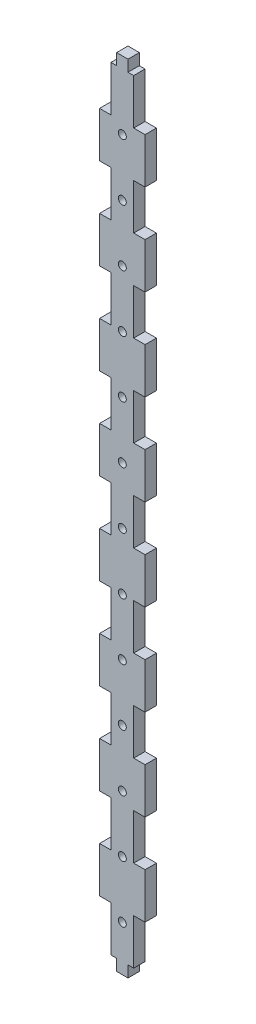
from build123d import *

# Parameters (mm, degrees)
MODEL_R             = 1.75
BOSS_EXTRUDE1_DEPTH = 5


with BuildPart() as part:
    # Model → Boss-Extrude1 (new body)
    with BuildSketch(Plane.XY):
        Polygon((8.224660595, 172.5), (8.224660595, 167.5), (5.724660595, 167.5), (5.724660595, 147.5), (0.724660595, 147.5), (0.724660595, 127.5), (5.724660595, 127.5), (5.724660595, 107.5), (0.724660595, 107.5), (0.724660595, 87.5), (5.724660595, 87.5), (5.724660595, 67.5), (0.724660595, 67.5), (0.724660595, 47.5), (5.724660595, 47.5), (5.724660595, 27.5), (0.724660595, 27.5), (0.724660595, 7.5), (5.724660595, 7.5), (5.724660595, -12.5), (0.724660595, -12.5), (0.724660595, -32.5), (5.724660595, -32.5), (5.724660595, -52.5), (0.724660595, -52.5), (0.724660595, -72.5), (5.724660595, -72.5), (5.724660595, -92.5), (0.724660595, -92.5), (0.724660595, -112.5), (5.724660595, -112.5), (5.724660595, -132.5), (0.724660595, -132.5), (0.724660595, -152.5), (5.724660595, -152.5), (5.724660595, -172.5), (8.224660595, -172.5), (8.224660595, -177.5), (13.224660595, -177.5), (13.224660595, -172.5), (15.724660595, -172.5), (15.724660595, -152.5), (20.724660595, -152.5), (20.724660595, -132.5), (15.724660595, -132.5), (15.724660595, -112.5), (20.724660595, -112.5), (20.724660595, -92.5), (15.724660595, -92.5), (15.724660595, -72.5), (20.724660595, -72.5), (20.724660595, -52.5), (15.724660595, -52.5), (15.724660595, -32.5), (20.724660595, -32.5), (20.724660595, -12.5), (15.724660595, -12.5), (15.724660595, 7.5), (20.724660595, 7.5), (20.724660595, 27.5), (15.724660595, 27.5), (15.724660595, 47.5), (20.724660595, 47.5), (20.724660595, 67.5), (15.724660595, 67.5), (15.724660595, 87.5), (20.724660595, 87.5), (20.724660595, 107.5), (15.724660595, 107.5), (15.724660595, 127.5), (20.724660595, 127.5), (20.724660595, 147.5), (15.724660595, 147.5), (15.724660595, 167.5), (13.224660595, 167.5), (13.224660595, 172.5), align=None)
        with Locations((10.724660595, 142.5)):
            Circle(MODEL_R, mode=Mode.SUBTRACT)
        with Locations((10.724660595, 92.5)):
            Circle(MODEL_R, mode=Mode.SUBTRACT)
        with Locations((10.724660595, 42.5)):
            Circle(MODEL_R, mode=Mode.SUBTRACT)
        with Locations((10.724660595, -7.5)):
            Circle(MODEL_R, mode=Mode.SUBTRACT)
        with Locations((10.724660595, -57.5)):
            Circle(MODEL_R, mode=Mode.SUBTRACT)
        with Locations((10.724660595, -107.5)):
            Circle(MODEL_R, mode=Mode.SUBTRACT)
        with Locations((10.724660595, -157.5)):
            Circle(MODEL_R, mode=Mode.SUBTRACT)
        with Locations((10.724660595, -132.5)):
            Circle(MODEL_R, mode=Mode.SUBTRACT)
        with Locations((10.724660595, -82.5)):
            Circle(MODEL_R, mode=Mode.SUBTRACT)
        with Locations((10.724660595, -32.5)):
            Circle(MODEL_R, mode=Mode.SUBTRACT)
        with Locations((10.724660595, 17.5)):
            Circle(MODEL_R, mode=Mode.SUBTRACT)
        with Locations((10.724660595, 67.5)):
            Circle(MODEL_R, mode=Mode.SUBTRACT)
        with Locations((10.724660595, 117.5)):
            Circle(MODEL_R, mode=Mode.SUBTRACT)
    extrude(amount=BOSS_EXTRUDE1_DEPTH)


solid = part.part
